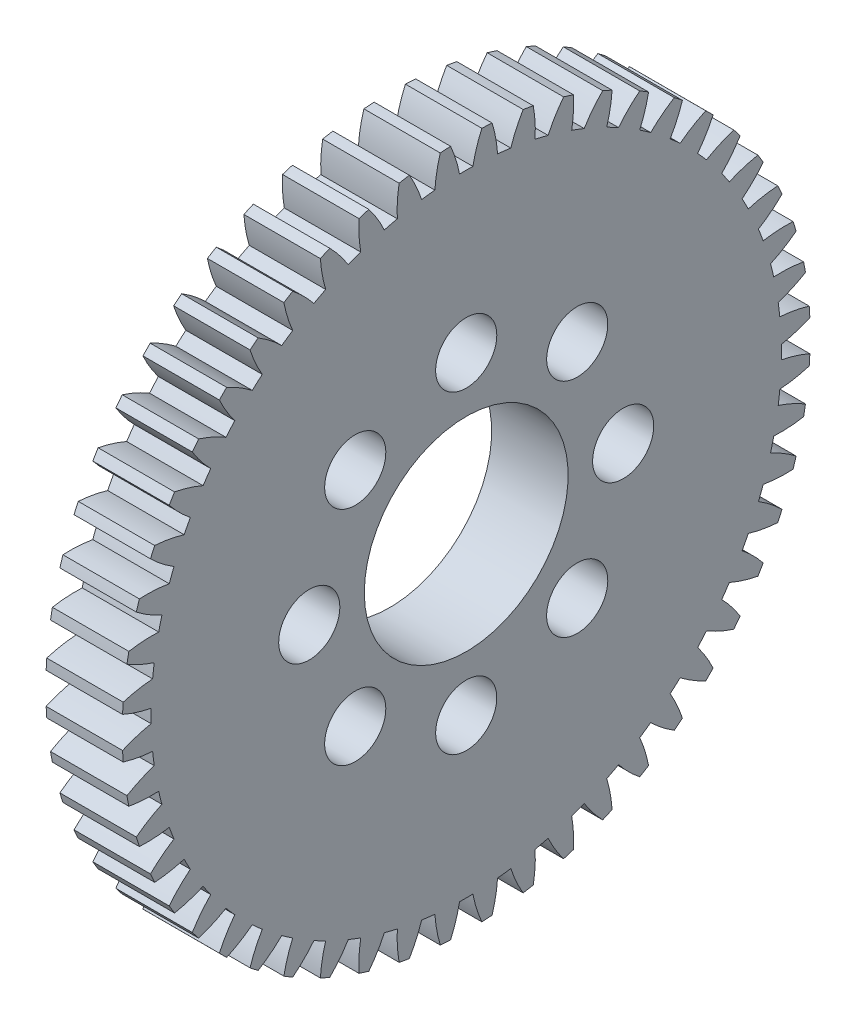
from build123d import *

# Parameters (mm, degrees)
SKETCH1_R           = 6.35
BOSS_EXTRUDE1_DEPTH = 4.7625
SKETCH2_R           = 1.905
CUT_EXTRUDE1_DEPTH  = 42.633486448
CIRPATTERN1_COUNT   = 8


with BuildPart() as part:
    # Sketch1 → Boss-Extrude1 (new body)
    with BuildSketch(Plane(origin=(-28.208162888, 0, 0), x_dir=(0, 0, -1), z_dir=(1, 0, 0))):
        with BuildLine():
            ThreePointArc((-34.348663113, 2.603291625), (-33.474733893, 2.274656143), (-32.569283938, 2.046809833))
            ThreePointArc((-32.569283938, 2.046809833), (-32.573693968, 1.630690443), (-32.569283938, 1.214571054))
            ThreePointArc((-32.569283938, 1.214571054), (-33.474733893, 0.986724744), (-34.348663113, 0.658089261))
            ThreePointArc((-34.348663113, 0.658089261), (-34.331643814, 0.33670377), (-34.309800283, 0.015610092))
            ThreePointArc((-34.309800283, 0.015610092), (-33.402630361, -0.205288741), (-32.476318318, -0.322333863))
            ThreePointArc((-32.476318318, -0.322333863), (-32.430538544, -0.735950844), (-32.376003019, -1.148504685))
            ThreePointArc((-32.376003019, -1.148504685), (-33.247387386, -1.48382967), (-34.075332048, -1.915409557))
            ThreePointArc((-34.075332048, -1.915409557), (-34.019698098, -2.232400336), (-33.959310265, -2.548519934))
            ThreePointArc((-33.959310265, -2.548519934), (-33.032128222, -2.658460914), (-32.098461806, -2.662998067))
            ThreePointArc((-32.098461806, -2.662998067), (-32.003159799, -3.068081173), (-31.899294029, -3.4710535))
            ThreePointArc((-31.899294029, -3.4710535), (-32.723906063, -3.908967368), (-33.49379287, -4.437198252))
            ThreePointArc((-33.49379287, -4.437198252), (-33.400355538, -4.74517188), (-33.302303994, -5.051707661))
            ThreePointArc((-33.302303994, -5.051707661), (-32.36863023, -5.049087602), (-31.4412244, -4.941050624))
            ThreePointArc((-31.4412244, -4.941050624), (-31.29778988, -5.33169283), (-31.146108462, -5.7192074))
            ThreePointArc((-31.146108462, -5.7192074), (-31.911923461, -6.25332438), (-32.612525729, -6.870503466))
            ThreePointArc((-32.612525729, -6.870503466), (-32.482647542, -7.164968994), (-32.348362098, -7.457450976))
            ThreePointArc((-32.348362098, -7.457450976), (-31.421811681, -7.342308085), (-30.514190102, -7.123272398))
            ThreePointArc((-30.514190102, -7.123272398), (-30.324714667, -7.493777261), (-30.127429457, -7.860183239))
            ThreePointArc((-30.127429457, -7.860183239), (-30.823280115, -8.482714703), (-31.444381485, -9.17984213))
            ThreePointArc((-31.444381485, -9.17984213), (-31.27995636, -9.456505587), (-31.111395201, -9.730668725))
            ThreePointArc((-31.111395201, -9.730668725), (-30.205479321, -9.504682043), (-29.33087716, -9.177841681))
            ThreePointArc((-29.33087716, -9.177841681), (-29.098123787, -9.522806407), (-28.858111649, -9.862760769))
            ThreePointArc((-28.858111649, -9.862760769), (-29.473850897, -10.564628805), (-30.006394313, -11.331538886))
            ThreePointArc((-30.006394313, -11.331538886), (-29.809819937, -11.586365896), (-29.609441064, -11.838212273))
            ThreePointArc((-29.609441064, -11.838212273), (-28.737370015, -11.504677196), (-27.908540941, -11.074798227))
            ThreePointArc((-27.908540941, -11.074798227), (-27.635903699, -11.389192453), (-27.356664549, -11.697737899))
            ThreePointArc((-27.356664549, -11.697737899), (-27.883313522, -12.468707691), (-28.319533301, -13.29421715))
            ThreePointArc((-28.319533301, -13.29421715), (-28.093676172, -13.523491761), (-27.864401561, -13.749348891))
            ThreePointArc((-27.864401561, -13.749348891), (-27.038892102, -13.313129111), (-26.267922309, -12.786480138))
            ThreePointArc((-26.267922309, -12.786480138), (-25.959376864, -13.065719289), (-25.644982638, -13.33835653))
            ThreePointArc((-25.644982638, -13.33835653), (-26.074861607, -14.167185604), (-26.408396684, -15.039256653))
            ThreePointArc((-26.408396684, -15.039256653), (-26.156550307, -15.239635526), (-25.901723297, -15.436209902))
            ThreePointArc((-25.901723297, -15.436209902), (-25.134813216, -14.903666486), (-24.43294518, -14.287927238))
            ThreePointArc((-24.43294518, -14.287927238), (-24.092990818, -14.527939377), (-23.748026092, -14.760692749))
            ThreePointArc((-23.748026092, -14.760692749), (-24.074866454, -15.63529491), (-24.300853135, -16.54121079))
            ThreePointArc((-24.300853135, -16.54121079), (-24.026689998, -16.709771949), (-23.750026541, -16.874197075))
            ThreePointArc((-23.750026541, -16.874197075), (-23.052899114, -16.253095705), (-22.43036765, -15.557245046))
            ThreePointArc((-22.43036765, -15.557245046), (-22.063961672, -15.754530256), (-21.693456809, -15.944005691))
            ThreePointArc((-21.693456809, -15.944005691), (-21.912492496, -16.85162727), (-22.027635387, -17.778177687))
            ThreePointArc((-22.027635387, -17.778177687), (-21.735153405, -17.912463131), (-21.440687877, -18.042341318))
            ThreePointArc((-21.440687877, -18.042341318), (-20.823508791, -17.341739051), (-20.289391811, -16.575924051))
            ThreePointArc((-20.289391811, -16.575924051), (-19.901877241, -16.727605469), (-19.511235035, -16.871039989))
            ThreePointArc((-19.511235035, -16.871039989), (-19.619272013, -17.798445819), (-19.621892071, -18.732119583))
            ThreePointArc((-19.621892071, -18.732119583), (-19.315356291, -18.830171127), (-19.007382663, -18.923608459))
            ThreePointArc((-19.007382663, -18.923608459), (-18.479151779, -18.153721652), (-18.041237911, -17.329109619))
            ThreePointArc((-18.041237911, -17.329109619), (-17.638265583, -17.432975389), (-17.233182478, -17.528277395))
            ThreePointArc((-17.233182478, -17.528277395), (-17.228645325, -18.461943811), (-17.118704344, -19.389125855))
            ThreePointArc((-17.118704344, -19.389125855), (-16.802584747, -19.449513688), (-16.485593968, -19.505147637))
            ThreePointArc((-16.485593968, -19.505147637), (-16.054014081, -18.677202975), (-15.718689096, -17.805818608))
            ThreePointArc((-15.718689096, -17.805818608), (-15.306135255, -17.860354133), (-14.892518274, -17.906133907))
            ThreePointArc((-14.892518274, -17.906133907), (-14.775473152, -18.83244595), (-14.554574319, -19.739615872))
            ThreePointArc((-14.554574319, -19.739615872), (-14.233480641, -19.761459403), (-13.91209515, -19.778478702))
            ThreePointArc((-13.91209515, -19.778478702), (-13.583459667, -18.904549482), (-13.355613357, -17.999099528))
            ThreePointArc((-13.355613357, -17.999099528), (-12.939493968, -18.003509557), (-12.523374578, -17.999099528))
            ThreePointArc((-12.523374578, -17.999099528), (-12.295528268, -18.904549482), (-11.966892786, -19.778478702))
            ThreePointArc((-11.966892786, -19.778478702), (-11.645507295, -19.761459403), (-11.324413616, -19.739615872))
            ThreePointArc((-11.324413616, -19.739615872), (-11.103514783, -18.83244595), (-10.986469661, -17.906133907))
            ThreePointArc((-10.986469661, -17.906133907), (-10.57285268, -17.860354133), (-10.16029884, -17.805818608))
            ThreePointArc((-10.16029884, -17.805818608), (-9.824973854, -18.677202975), (-9.393393968, -19.505147637))
            ThreePointArc((-9.393393968, -19.505147637), (-9.076403189, -19.449513688), (-8.760283591, -19.389125855))
            ThreePointArc((-8.760283591, -19.389125855), (-8.65034261, -18.461943811), (-8.645805457, -17.528277395))
            ThreePointArc((-8.645805457, -17.528277395), (-8.240722352, -17.432975389), (-7.837750025, -17.329109619))
            ThreePointArc((-7.837750025, -17.329109619), (-7.399836157, -18.153721652), (-6.871605273, -18.923608459))
            ThreePointArc((-6.871605273, -18.923608459), (-6.563631645, -18.830171127), (-6.257095864, -18.732119583))
            ThreePointArc((-6.257095864, -18.732119583), (-6.259715922, -17.798445819), (-6.367752901, -16.871039989))
            ThreePointArc((-6.367752901, -16.871039989), (-5.977110695, -16.727605469), (-5.589596124, -16.575924051))
            ThreePointArc((-5.589596124, -16.575924051), (-5.055479145, -17.341739051), (-4.438300058, -18.042341318))
            ThreePointArc((-4.438300058, -18.042341318), (-4.143834531, -17.912463131), (-3.851352549, -17.778177687))
            ThreePointArc((-3.851352549, -17.778177687), (-3.96649544, -16.85162727), (-4.185531127, -15.944005691))
            ThreePointArc((-4.185531127, -15.944005691), (-3.815026263, -15.754530256), (-3.448620285, -15.557245046))
            ThreePointArc((-3.448620285, -15.557245046), (-2.826088822, -16.253095705), (-2.128961394, -16.874197075))
            ThreePointArc((-2.128961394, -16.874197075), (-1.852297938, -16.709771949), (-1.5781348, -16.54121079))
            ThreePointArc((-1.5781348, -16.54121079), (-1.804121481, -15.63529491), (-2.130961844, -14.760692749))
            ThreePointArc((-2.130961844, -14.760692749), (-1.785997117, -14.527939377), (-1.446042756, -14.287927238))
            ThreePointArc((-1.446042756, -14.287927238), (-0.744174719, -14.903666486), (0.022735361, -15.436209902))
            ThreePointArc((0.022735361, -15.436209902), (0.277562371, -15.239635526), (0.529408748, -15.039256653))
            ThreePointArc((0.529408748, -15.039256653), (0.195873672, -14.167185604), (-0.234005297, -13.33835653))
            ThreePointArc((-0.234005297, -13.33835653), (0.080388929, -13.065719289), (0.388934374, -12.786480138))
            ThreePointArc((0.388934374, -12.786480138), (1.159904167, -13.313129111), (1.985413625, -13.749348891))
            ThreePointArc((1.985413625, -13.749348891), (2.214688237, -13.523491761), (2.440545366, -13.29421715))
            ThreePointArc((2.440545366, -13.29421715), (2.004325586, -12.468707691), (1.477676614, -11.697737899))
            ThreePointArc((1.477676614, -11.697737899), (1.756915764, -11.389192453), (2.029553005, -11.074798227))
            ThreePointArc((2.029553005, -11.074798227), (2.858382079, -11.504677196), (3.730453128, -11.838212273))
            ThreePointArc((3.730453128, -11.838212273), (3.930832001, -11.586365896), (4.127406377, -11.331538886))
            ThreePointArc((4.127406377, -11.331538886), (3.594862961, -10.564628805), (2.979123713, -9.862760769))
            ThreePointArc((2.979123713, -9.862760769), (3.219135852, -9.522806407), (3.451889225, -9.177841681))
            ThreePointArc((3.451889225, -9.177841681), (4.326491385, -9.504682043), (5.232407265, -9.730668725))
            ThreePointArc((5.232407265, -9.730668725), (5.400968424, -9.456505587), (5.56539355, -9.17984213))
            ThreePointArc((5.56539355, -9.17984213), (4.94429218, -8.482714703), (4.248441521, -7.860183239))
            ThreePointArc((4.248441521, -7.860183239), (4.445726731, -7.493777261), (4.635202167, -7.123272398))
            ThreePointArc((4.635202167, -7.123272398), (5.542823745, -7.342308085), (6.469374163, -7.457450976))
            ThreePointArc((6.469374163, -7.457450976), (6.603659607, -7.164968994), (6.733537794, -6.870503466))
            ThreePointArc((6.733537794, -6.870503466), (6.032935526, -6.25332438), (5.267120526, -5.7192074))
            ThreePointArc((5.267120526, -5.7192074), (5.418801944, -5.33169283), (5.562236464, -4.941050624))
            ThreePointArc((5.562236464, -4.941050624), (6.489642294, -5.049087602), (7.423316058, -5.051707661))
            ThreePointArc((7.423316058, -5.051707661), (7.521367603, -4.74517188), (7.614804934, -4.437198252))
            ThreePointArc((7.614804934, -4.437198252), (6.844918128, -3.908967368), (6.020306094, -3.4710535))
            ThreePointArc((6.020306094, -3.4710535), (6.124171864, -3.068081173), (6.21947387, -2.662998067))
            ThreePointArc((6.21947387, -2.662998067), (7.153140286, -2.658460914), (8.08032233, -2.548519934))
            ThreePointArc((8.08032233, -2.548519934), (8.140710163, -2.232400336), (8.196344112, -1.915409557))
            ThreePointArc((8.196344112, -1.915409557), (7.368399451, -1.48382967), (6.497015083, -1.148504685))
            ThreePointArc((6.497015083, -1.148504685), (6.551550608, -0.735950844), (6.597330383, -0.322333863))
            ThreePointArc((6.597330383, -0.322333863), (7.523642426, -0.205288741), (8.430812348, 0.015610092))
            ThreePointArc((8.430812348, 0.015610092), (8.452655879, 0.33670377), (8.469675178, 0.658089261))
            ThreePointArc((8.469675178, 0.658089261), (7.595745958, 0.986724744), (6.690296003, 1.214571054))
            ThreePointArc((6.690296003, 1.214571054), (6.694706032, 1.630690443), (6.690296003, 2.046809833))
            ThreePointArc((6.690296003, 2.046809833), (7.595745958, 2.274656143), (8.469675178, 2.603291625))
            ThreePointArc((8.469675178, 2.603291625), (8.452655879, 2.924677116), (8.430812348, 3.245770795))
            ThreePointArc((8.430812348, 3.245770795), (7.523642426, 3.466669627), (6.597330383, 3.58371475))
            ThreePointArc((6.597330383, 3.58371475), (6.551550608, 3.997331731), (6.497015083, 4.409885571))
            ThreePointArc((6.497015083, 4.409885571), (7.368399451, 4.745210557), (8.196344112, 5.176790443))
            ThreePointArc((8.196344112, 5.176790443), (8.140710163, 5.493781222), (8.08032233, 5.80990082))
            ThreePointArc((8.08032233, 5.80990082), (7.153140286, 5.919841801), (6.21947387, 5.924378953))
            ThreePointArc((6.21947387, 5.924378953), (6.124171864, 6.329462059), (6.020306094, 6.732434386))
            ThreePointArc((6.020306094, 6.732434386), (6.844918128, 7.170348254), (7.614804934, 7.698579138))
            ThreePointArc((7.614804934, 7.698579138), (7.521367603, 8.006552766), (7.423316058, 8.313088547))
            ThreePointArc((7.423316058, 8.313088547), (6.489642294, 8.310468489), (5.562236464, 8.20243151))
            ThreePointArc((5.562236464, 8.20243151), (5.418801944, 8.593073716), (5.267120526, 8.980588287))
            ThreePointArc((5.267120526, 8.980588287), (6.032935526, 9.514705266), (6.733537794, 10.131884352))
            ThreePointArc((6.733537794, 10.131884352), (6.603659607, 10.42634988), (6.469374163, 10.718831862))
            ThreePointArc((6.469374163, 10.718831862), (5.542823745, 10.603688971), (4.635202167, 10.384653284))
            ThreePointArc((4.635202167, 10.384653284), (4.445726731, 10.755158148), (4.248441521, 11.121564126))
            ThreePointArc((4.248441521, 11.121564126), (4.94429218, 11.744095589), (5.56539355, 12.441223016))
            ThreePointArc((5.56539355, 12.441223016), (5.400968424, 12.717886473), (5.232407265, 12.992049611))
            ThreePointArc((5.232407265, 12.992049611), (4.326491385, 12.76606293), (3.451889225, 12.439222567))
            ThreePointArc((3.451889225, 12.439222567), (3.219135852, 12.784187293), (2.979123713, 13.124141655))
            ThreePointArc((2.979123713, 13.124141655), (3.594862961, 13.826009691), (4.127406377, 14.592919772))
            ThreePointArc((4.127406377, 14.592919772), (3.930832001, 14.847746782), (3.730453128, 15.099593159))
            ThreePointArc((3.730453128, 15.099593159), (2.858382079, 14.766058083), (2.029553005, 14.336179114))
            ThreePointArc((2.029553005, 14.336179114), (1.756915764, 14.65057334), (1.477676614, 14.959118785))
            ThreePointArc((1.477676614, 14.959118785), (2.004325586, 15.730088578), (2.440545366, 16.555598036))
            ThreePointArc((2.440545366, 16.555598036), (2.214688237, 16.784872647), (1.985413625, 17.010729777))
            ThreePointArc((1.985413625, 17.010729777), (1.159904167, 16.574509997), (0.388934374, 16.047861025))
            ThreePointArc((0.388934374, 16.047861025), (0.080388929, 16.327100175), (-0.234005297, 16.599737416))
            ThreePointArc((-0.234005297, 16.599737416), (0.195873672, 17.42856649), (0.529408748, 18.300637539))
            ThreePointArc((0.529408748, 18.300637539), (0.277562371, 18.501016412), (0.022735361, 18.697590788))
            ThreePointArc((0.022735361, 18.697590788), (-0.744174719, 18.165047372), (-1.446042756, 17.549308124))
            ThreePointArc((-1.446042756, 17.549308124), (-1.785997117, 17.789320263), (-2.130961844, 18.022073636))
            ThreePointArc((-2.130961844, 18.022073636), (-1.804121481, 18.896675796), (-1.5781348, 19.802591676))
            ThreePointArc((-1.5781348, 19.802591676), (-1.852297938, 19.971152835), (-2.128961394, 20.135577961))
            ThreePointArc((-2.128961394, 20.135577961), (-2.826088822, 19.514476591), (-3.448620285, 18.818625932))
            ThreePointArc((-3.448620285, 18.818625932), (-3.815026263, 19.015911142), (-4.185531127, 19.205386578))
            ThreePointArc((-4.185531127, 19.205386578), (-3.96649544, 20.113008156), (-3.851352549, 21.039558574))
            ThreePointArc((-3.851352549, 21.039558574), (-4.143834531, 21.173844018), (-4.438300058, 21.303722204))
            ThreePointArc((-4.438300058, 21.303722204), (-5.055479145, 20.603119937), (-5.589596124, 19.837304937))
            ThreePointArc((-5.589596124, 19.837304937), (-5.977110695, 19.988986355), (-6.367752901, 20.132420875))
            ThreePointArc((-6.367752901, 20.132420875), (-6.259715922, 21.059826705), (-6.257095864, 21.993500469))
            ThreePointArc((-6.257095864, 21.993500469), (-6.563631645, 22.091552014), (-6.871605273, 22.184989345))
            ThreePointArc((-6.871605273, 22.184989345), (-7.399836157, 21.415102539), (-7.837750025, 20.590490505))
            ThreePointArc((-7.837750025, 20.590490505), (-8.240722352, 20.694356275), (-8.645805457, 20.789658281))
            ThreePointArc((-8.645805457, 20.789658281), (-8.65034261, 21.723324697), (-8.760283591, 22.650506741))
            ThreePointArc((-8.760283591, 22.650506741), (-9.076403189, 22.710894574), (-9.393393968, 22.766528523))
            ThreePointArc((-9.393393968, 22.766528523), (-9.824973854, 21.938583861), (-10.16029884, 21.067199494))
            ThreePointArc((-10.16029884, 21.067199494), (-10.57285268, 21.121735019), (-10.986469661, 21.167514794))
            ThreePointArc((-10.986469661, 21.167514794), (-11.103514783, 22.093826837), (-11.324413616, 23.000996759))
            ThreePointArc((-11.324413616, 23.000996759), (-11.645507295, 23.02284029), (-11.966892786, 23.039859589))
            ThreePointArc((-11.966892786, 23.039859589), (-12.295528268, 22.165930369), (-12.523374578, 21.260480414))
            ThreePointArc((-12.523374578, 21.260480414), (-12.939493968, 21.264890443), (-13.355613357, 21.260480414))
            ThreePointArc((-13.355613357, 21.260480414), (-13.583459667, 22.165930369), (-13.91209515, 23.039859589))
            ThreePointArc((-13.91209515, 23.039859589), (-14.233480641, 23.02284029), (-14.554574319, 23.000996759))
            ThreePointArc((-14.554574319, 23.000996759), (-14.775473152, 22.093826837), (-14.892518274, 21.167514794))
            ThreePointArc((-14.892518274, 21.167514794), (-15.306135255, 21.121735019), (-15.718689096, 21.067199494))
            ThreePointArc((-15.718689096, 21.067199494), (-16.054014081, 21.938583861), (-16.485593968, 22.766528523))
            ThreePointArc((-16.485593968, 22.766528523), (-16.802584747, 22.710894574), (-17.118704344, 22.650506741))
            ThreePointArc((-17.118704344, 22.650506741), (-17.228645325, 21.723324697), (-17.233182478, 20.789658281))
            ThreePointArc((-17.233182478, 20.789658281), (-17.638265583, 20.694356275), (-18.041237911, 20.590490505))
            ThreePointArc((-18.041237911, 20.590490505), (-18.479151779, 21.415102539), (-19.007382663, 22.184989345))
            ThreePointArc((-19.007382663, 22.184989345), (-19.315356291, 22.091552014), (-19.621892071, 21.993500469))
            ThreePointArc((-19.621892071, 21.993500469), (-19.619272013, 21.059826705), (-19.511235035, 20.132420875))
            ThreePointArc((-19.511235035, 20.132420875), (-19.901877241, 19.988986355), (-20.289391811, 19.837304937))
            ThreePointArc((-20.289391811, 19.837304937), (-20.823508791, 20.603119937), (-21.440687877, 21.303722204))
            ThreePointArc((-21.440687877, 21.303722204), (-21.735153405, 21.173844018), (-22.027635387, 21.039558574))
            ThreePointArc((-22.027635387, 21.039558574), (-21.912492496, 20.113008156), (-21.693456809, 19.205386578))
            ThreePointArc((-21.693456809, 19.205386578), (-22.063961672, 19.015911142), (-22.43036765, 18.818625932))
            ThreePointArc((-22.43036765, 18.818625932), (-23.052899114, 19.514476591), (-23.750026541, 20.135577961))
            ThreePointArc((-23.750026541, 20.135577961), (-24.026689998, 19.971152835), (-24.300853135, 19.802591676))
            ThreePointArc((-24.300853135, 19.802591676), (-24.074866454, 18.896675796), (-23.748026092, 18.022073636))
            ThreePointArc((-23.748026092, 18.022073636), (-24.092990818, 17.789320263), (-24.43294518, 17.549308124))
            ThreePointArc((-24.43294518, 17.549308124), (-25.134813216, 18.165047372), (-25.901723297, 18.697590788))
            ThreePointArc((-25.901723297, 18.697590788), (-26.156550307, 18.501016412), (-26.408396684, 18.300637539))
            ThreePointArc((-26.408396684, 18.300637539), (-26.074861607, 17.42856649), (-25.644982638, 16.599737416))
            ThreePointArc((-25.644982638, 16.599737416), (-25.959376864, 16.327100175), (-26.267922309, 16.047861025))
            ThreePointArc((-26.267922309, 16.047861025), (-27.038892102, 16.574509997), (-27.864401561, 17.010729777))
            ThreePointArc((-27.864401561, 17.010729777), (-28.093676172, 16.784872647), (-28.319533301, 16.555598036))
            ThreePointArc((-28.319533301, 16.555598036), (-27.883313522, 15.730088578), (-27.356664549, 14.959118785))
            ThreePointArc((-27.356664549, 14.959118785), (-27.635903699, 14.65057334), (-27.908540941, 14.336179114))
            ThreePointArc((-27.908540941, 14.336179114), (-28.737370015, 14.766058083), (-29.609441064, 15.099593159))
            ThreePointArc((-29.609441064, 15.099593159), (-29.809819937, 14.847746782), (-30.006394313, 14.592919772))
            ThreePointArc((-30.006394313, 14.592919772), (-29.473850897, 13.826009691), (-28.858111649, 13.124141655))
            ThreePointArc((-28.858111649, 13.124141655), (-29.098123787, 12.784187293), (-29.33087716, 12.439222567))
            ThreePointArc((-29.33087716, 12.439222567), (-30.205479321, 12.76606293), (-31.111395201, 12.992049611))
            ThreePointArc((-31.111395201, 12.992049611), (-31.27995636, 12.717886473), (-31.444381485, 12.441223016))
            ThreePointArc((-31.444381485, 12.441223016), (-30.823280115, 11.744095589), (-30.127429457, 11.121564126))
            ThreePointArc((-30.127429457, 11.121564126), (-30.324714667, 10.755158148), (-30.514190102, 10.384653284))
            ThreePointArc((-30.514190102, 10.384653284), (-31.421811681, 10.603688971), (-32.348362098, 10.718831862))
            ThreePointArc((-32.348362098, 10.718831862), (-32.482647542, 10.42634988), (-32.612525729, 10.131884352))
            ThreePointArc((-32.612525729, 10.131884352), (-31.911923461, 9.514705266), (-31.146108462, 8.980588287))
            ThreePointArc((-31.146108462, 8.980588287), (-31.29778988, 8.593073716), (-31.4412244, 8.20243151))
            ThreePointArc((-31.4412244, 8.20243151), (-32.36863023, 8.310468489), (-33.302303994, 8.313088547))
            ThreePointArc((-33.302303994, 8.313088547), (-33.400355538, 8.006552766), (-33.49379287, 7.698579138))
            ThreePointArc((-33.49379287, 7.698579138), (-32.723906063, 7.170348254), (-31.899294029, 6.732434386))
            ThreePointArc((-31.899294029, 6.732434386), (-32.003159799, 6.329462059), (-32.098461806, 5.924378953))
            ThreePointArc((-32.098461806, 5.924378953), (-33.032128222, 5.919841801), (-33.959310265, 5.80990082))
            ThreePointArc((-33.959310265, 5.80990082), (-34.019698098, 5.493781222), (-34.075332048, 5.176790443))
            ThreePointArc((-34.075332048, 5.176790443), (-33.247387386, 4.745210557), (-32.376003019, 4.409885571))
            ThreePointArc((-32.376003019, 4.409885571), (-32.430538544, 3.997331731), (-32.476318318, 3.58371475))
            ThreePointArc((-32.476318318, 3.58371475), (-33.402630361, 3.466669627), (-34.309800283, 3.245770795))
            ThreePointArc((-34.309800283, 3.245770795), (-34.331643814, 2.924677116), (-34.348663113, 2.603291625))
        make_face()
        with Locations(Location((-12.939493968, 1.630690443, 0), (0, 0, 180))):
            Circle(SKETCH1_R, mode=Mode.SUBTRACT)
    extrude(amount=-BOSS_EXTRUDE1_DEPTH)

    # Sketch2 → Cut-Extrude1 (cut, through all)
    with BuildSketch(Plane(origin=(-28.208162888, 0, 0), x_dir=(0, 0, -1), z_dir=(1, 0, 0))):
        with Locations((-12.939493968, 11.409690443)):
            Circle(SKETCH2_R)
    cut_extrude1 = extrude(amount=-CUT_EXTRUDE1_DEPTH, mode=Mode.SUBTRACT)

    # CirPattern1: Cut-Extrude1 ×8 about axis
    cirpattern1_axis = Axis((0, 1.630690443, 12.939493968), (1, 0, 0))
    for i in range(1, CIRPATTERN1_COUNT):
        add(cut_extrude1.rotate(cirpattern1_axis, i * 360 / CIRPATTERN1_COUNT), mode=Mode.SUBTRACT)


solid = part.part
